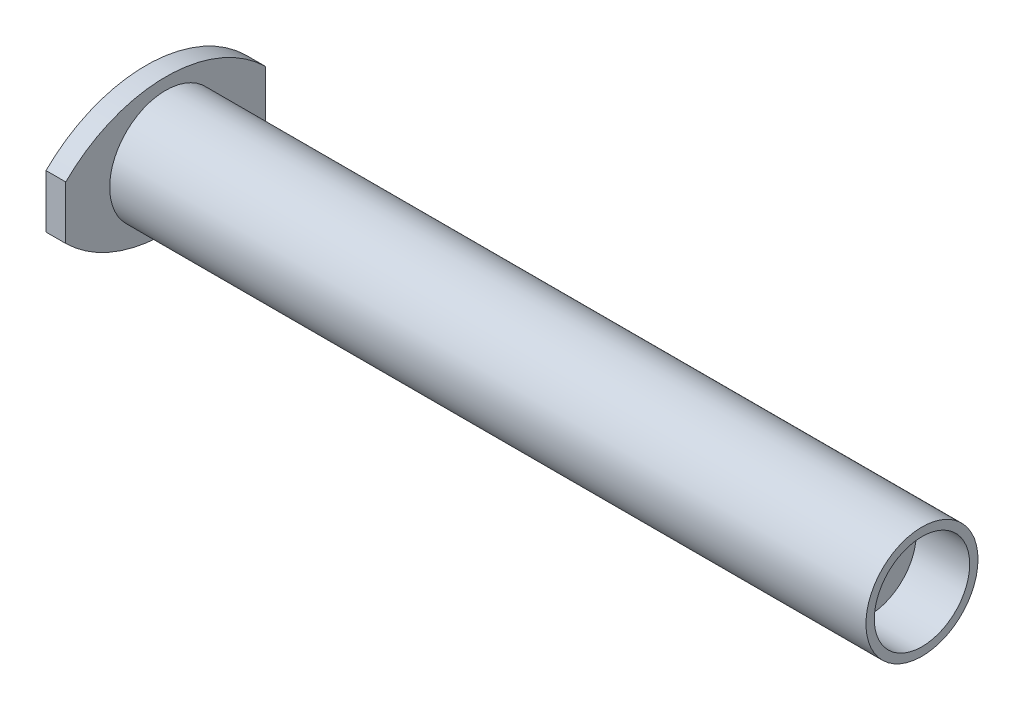
from build123d import *

# Parameters (mm, degrees)
SKETCH1_R           = 5.675
BOSS_EXTRUDE1_DEPTH = 76.6
BOSS_EXTRUDE2_DEPTH = 2
SKETCH3_R           = 4.83
CUT_EXTRUDE1_DEPTH  = 80.545861523
BOSS_EXTRUDE3_START = -1
SKETCH4_R           = 4.83
SKETCH4_R_2         = 1.71
BOSS_EXTRUDE3_DEPTH = 1
SKETCH5_R           = 4.83
SKETCH5_R_2         = 2.4
BOSS_EXTRUDE4_DEPTH = 1


with BuildPart() as part:
    # Sketch1 → Boss-Extrude1 (new body)
    with BuildSketch(Plane(origin=(0, 0, 0), x_dir=(0, 0, -1), z_dir=(1, 0, 0))):
        Circle(SKETCH1_R)
    extrude(amount=-BOSS_EXTRUDE1_DEPTH)

    # Sketch2 → Boss-Extrude2 (add)
    with BuildSketch(Plane.ZY.offset(76.6)):
        with BuildLine():
            Line((-10.125, -2.7), (-10.125, 2.7))
            ThreePointArc((-10.125, 2.7), (0, 6.860645772), (10.125, 2.7))
            Line((10.125, 2.7), (10.125, -2.7))
            ThreePointArc((10.125, -2.7), (0, -6.860645772), (-10.125, -2.7))
        make_face()
    extrude(amount=BOSS_EXTRUDE2_DEPTH)

    # Sketch3 → Cut-Extrude1 (cut, through all)
    with BuildSketch(Plane(origin=(0, 0, 0), x_dir=(0, 0, -1), z_dir=(1, 0, 0))):
        Circle(SKETCH3_R)
    extrude(amount=-CUT_EXTRUDE1_DEPTH, mode=Mode.SUBTRACT)

    # Sketch4 → Boss-Extrude3 (add)
    with BuildSketch(Plane.ZY.offset(60).offset(BOSS_EXTRUDE3_START)):
        with Locations(Location((0, 0, 0), (0, 0, 180))):
            Circle(SKETCH4_R)
        Circle(SKETCH4_R_2, mode=Mode.SUBTRACT)
    extrude(amount=BOSS_EXTRUDE3_DEPTH)

    # Sketch5 → Boss-Extrude4 (add)
    with BuildSketch(Plane(origin=(-5.4, 0, 0), x_dir=(0, 0, -1), z_dir=(1, 0, 0))):
        Circle(SKETCH5_R)
        Circle(SKETCH5_R_2, mode=Mode.SUBTRACT)
    extrude(amount=-BOSS_EXTRUDE4_DEPTH)


solid = part.part
